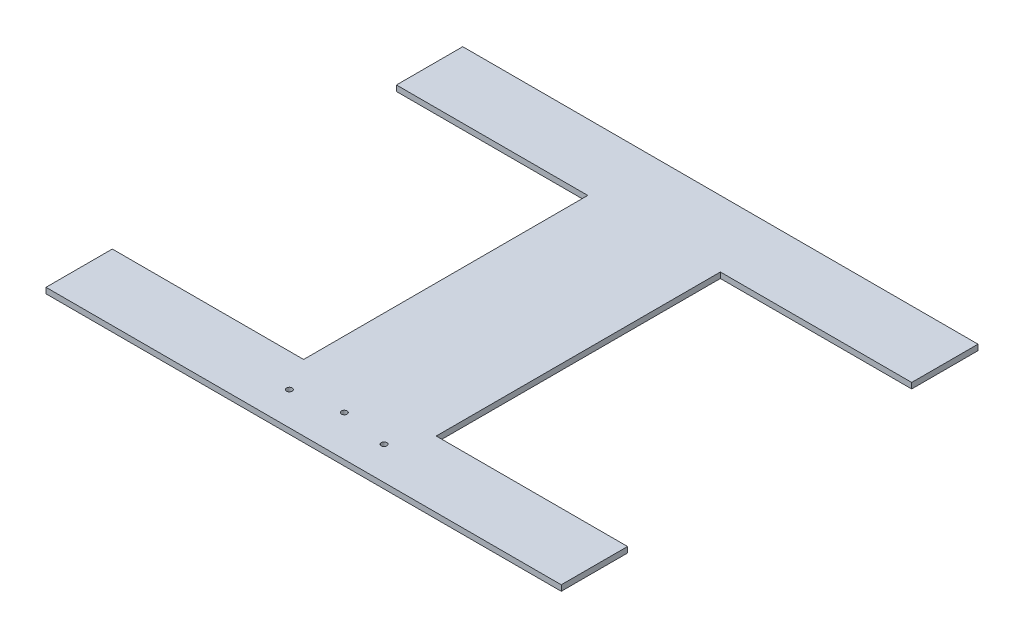
from build123d import *

# Parameters (mm, degrees)
SKETCH1_W           = 272
SKETCH1_H           = 220
BOSS_EXTRUDE1_DEPTH = 3
SKETCH2_OUTSIDE_W   = 343.97
SKETCH2_OUTSIDE_H   = 291.97
CUT_EXTRUDE1_DEPTH  = 175.94284781
SKETCH3_R           = 1.5
CUT_EXTRUDE2_DEPTH  = 175.94284781
SKETCH5_R           = 1.5
CUT_EXTRUDE4_DEPTH  = 175.94284781


with BuildPart() as part:
    # Sketch1 → Boss-Extrude1 (new body)
    with BuildSketch(Plane(origin=(0, 0, 0), x_dir=(1, 0, 0), z_dir=(0, 1, 0))):
        Rectangle(SKETCH1_W, SKETCH1_H)
    extrude(amount=BOSS_EXTRUDE1_DEPTH)

    # Sketch2 outside → Cut-Extrude1 (cut, through all)
    with BuildSketch(Plane(origin=(0, 3, 0), x_dir=(1, 0, 0), z_dir=(0, 1, 0))):
        Rectangle(SKETCH2_OUTSIDE_W, SKETCH2_OUTSIDE_H)
        Polygon((-136, 110), (136, 110), (136, 75), (35, 75), (35, -75), (136, -75), (136, -110), (-136, -110), (-136, -75), (-35, -75), (-35, 75), (-136, 75), align=None, mode=Mode.SUBTRACT)
    extrude(amount=-CUT_EXTRUDE1_DEPTH, mode=Mode.SUBTRACT)

    # Sketch3 → Cut-Extrude2 (cut, through all)
    with BuildSketch(Plane.XZ):
        with Locations(Location((25, 92.5, 0), (0, 0, 270))):
            Circle(SKETCH3_R)
        with Locations(Location((-25, 92.5, 0), (0, 0, 270))):
            Circle(SKETCH3_R)
    extrude(amount=-CUT_EXTRUDE2_DEPTH, mode=Mode.SUBTRACT)

    # Sketch5 → Cut-Extrude4 (cut, through all)
    with BuildSketch(Plane.XZ):
        with Locations(Location((0, 88.5, 0), (0, 0, 270))):
            Circle(SKETCH5_R)
    extrude(amount=-CUT_EXTRUDE4_DEPTH, mode=Mode.SUBTRACT)


solid = part.part
